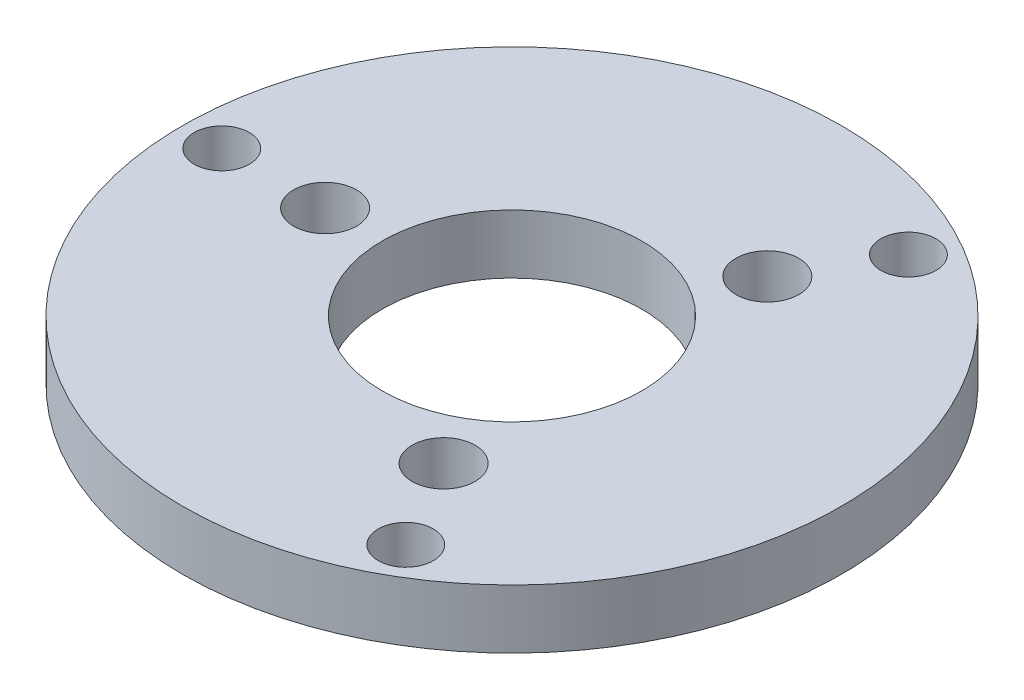
from build123d import *

# Parameters (mm, degrees)
SKETCH_1_R          = 16.75
EXTRUDE_1_DEPTH     = 3
SKETCH_2_R          = 1.6
CUT_EXTRUDE_1_DEPTH = 3
SKETCH_3_R          = 6.6
CUT_EXTRUDE_2_DEPTH = 3
SKETCH_4_R          = 1.4
CUT_EXTRUDE_3_DEPTH = 10


with BuildPart() as part:
    # 草图1 → 凸台-拉伸1 (new body)
    with BuildSketch(Plane(origin=(0, 0, 0), x_dir=(1, 0, 0), z_dir=(0, 1, 0))):
        with Locations(Location((0, 0, 0), (0, 0, 270))):
            Circle(SKETCH_1_R)
    extrude(amount=EXTRUDE_1_DEPTH)

    # 草图2 → 切除-拉伸1 (cut)
    with BuildSketch(Plane(origin=(0, 3, 0), x_dir=(1, 0, 0), z_dir=(0, 1, 0))):
        with Locations(Location((4.75, 8.227241336, 0), (0, 0, 270))):
            Circle(SKETCH_2_R)
        with Locations(Location((4.75, -8.227241336, 0), (0, 0, 270))):
            Circle(SKETCH_2_R)
        with Locations(Location((-9.5, 0, 0), (0, 0, 270))):
            Circle(SKETCH_2_R)
    extrude(amount=-CUT_EXTRUDE_1_DEPTH, mode=Mode.SUBTRACT)

    # 草图3 → 切除-拉伸2 (cut)
    with BuildSketch(Plane(origin=(0, 3, 0), x_dir=(1, 0, 0), z_dir=(0, 1, 0))):
        with Locations(Location((0, 0, 0), (0, 0, 270))):
            Circle(SKETCH_3_R)
    extrude(amount=-CUT_EXTRUDE_2_DEPTH, mode=Mode.SUBTRACT)

    # 草图4 → 切除-拉伸3 (cut)
    with BuildSketch(Plane(origin=(0, 3, 0), x_dir=(1, 0, 0), z_dir=(0, 1, 0))):
        with Locations(Location((-14.75, 0, 0), (0, 0, 270))):
            Circle(SKETCH_4_R)
        with Locations(Location((7.375, 12.773874706, 0), (0, 0, 270))):
            Circle(SKETCH_4_R)
        with Locations(Location((7.375, -12.773874706, 0), (0, 0, 270))):
            Circle(SKETCH_4_R)
    extrude(amount=-CUT_EXTRUDE_3_DEPTH, mode=Mode.SUBTRACT)


solid = part.part
